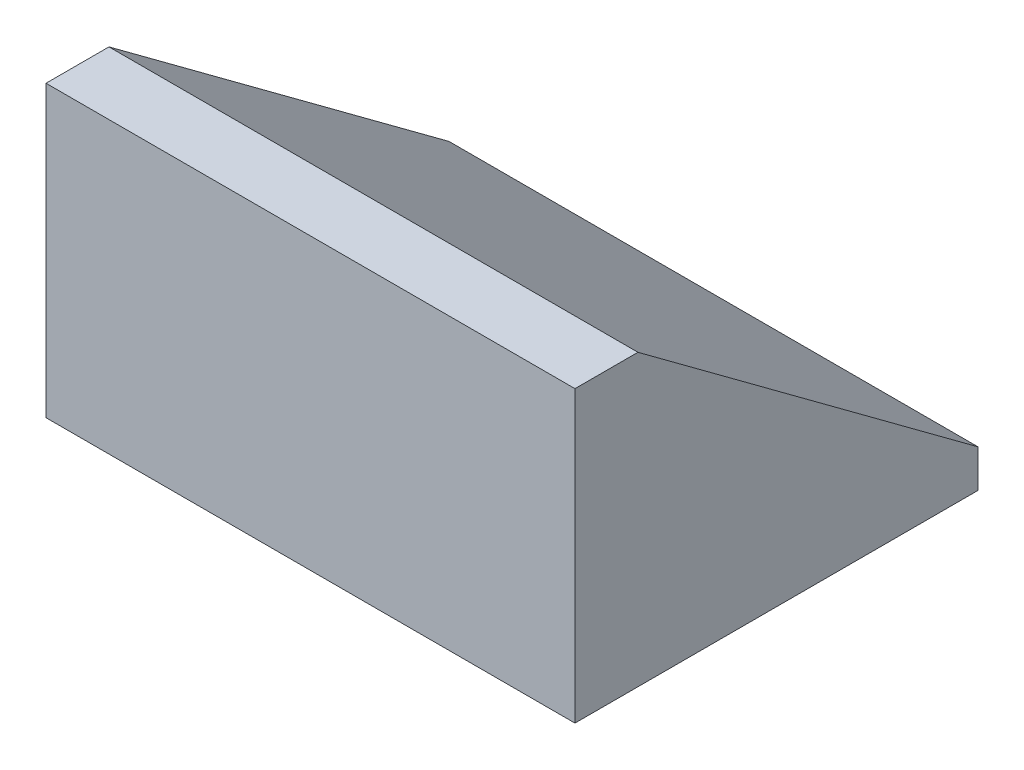
from build123d import *

# Parameters (mm, degrees)
SKETCH5_W           = 42
SKETCH5_H           = 23
BOSS_EXTRUDE2_DEPTH = 32
CUT_EXTRUDE3_DEPTH  = 42


with BuildPart() as part:
    # Sketch5 → Boss-Extrude2 (new body)
    with BuildSketch(Plane.XY.offset(-10)):
        Rectangle(SKETCH5_W, SKETCH5_H)
    extrude(amount=-BOSS_EXTRUDE2_DEPTH)

    # Sketch6 → Cut-Extrude3 (cut)
    with BuildSketch(Plane.ZY.offset(21)):
        Polygon((-42, 11.5), (-42, -8.5), (-15, 11.5), align=None)
    extrude(amount=-CUT_EXTRUDE3_DEPTH, mode=Mode.SUBTRACT)


solid = part.part
